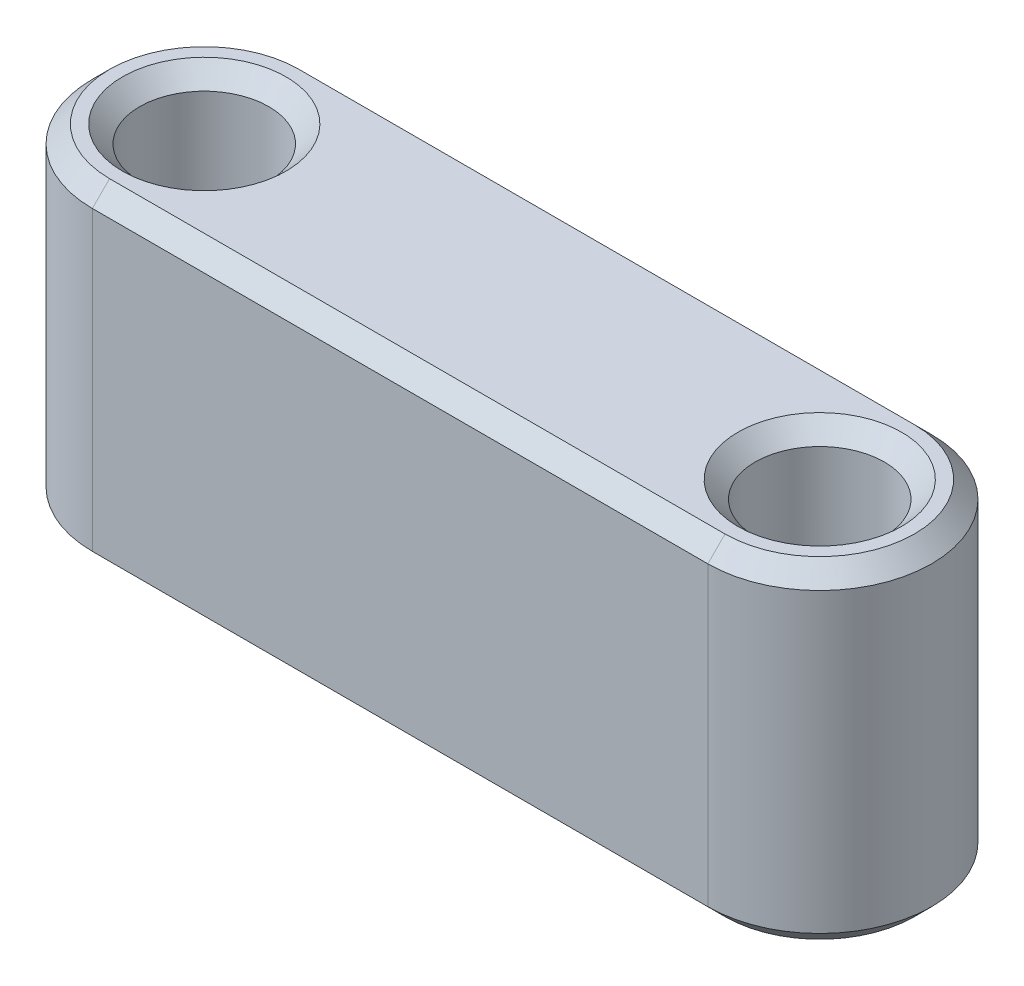
from build123d import *

# Parameters (mm, degrees)
SKETCH1_R           = 1.5
BOSS_EXTRUDE1_DEPTH = 3.85
CHAMFER2_SIZE       = 0.4


with BuildPart() as part:
    # Sketch1 → Boss-Extrude1 (new, symmetric)
    with BuildSketch(Plane(origin=(0, 0, 0), x_dir=(1, 0, 0), z_dir=(0, 1, 0))):
        with BuildLine():
            Line((-5.963610114, 2.6), (8.336389886, 2.6))
            ThreePointArc((8.336389886, 2.6), (10.936389886, 0), (8.336389886, -2.6))
            Line((8.336389886, -2.6), (-5.963610114, -2.6))
            ThreePointArc((-5.963610114, -2.6), (-8.563610114, 0), (-5.963610114, 2.6))
        make_face()
        with Locations(Location((-5.963610114, 0, 0), (0, 0, 90))):
            Circle(SKETCH1_R, mode=Mode.SUBTRACT)
        with Locations(Location((8.336389886, 0, 0), (0, 0, 90))):
            Circle(SKETCH1_R, mode=Mode.SUBTRACT)
    extrude(amount=BOSS_EXTRUDE1_DEPTH, both=True)

    # Chamfer2
    chamfer2_edges = [part.edges().sort_by_distance(p)[0] for p in [
        (-5.963610114, -3.85, 1.5),
        (-5.963610114, 3.85, 1.5),
        (10.936389886, 3.85, 0),
        (8.336389886, -3.85, 1.5),
        (8.336389886, 3.85, 1.5),
        (1.186389886, 3.85, -2.6),
        (-8.563610114, 3.85, 0),
        (1.186389886, -3.85, -2.6),
        (10.936389886, -3.85, 0),
        (1.186389886, -3.85, 2.6),
        (-8.563610114, -3.85, 0),
        (1.186389886, 3.85, 2.6),
    ]]
    chamfer(chamfer2_edges, length=CHAMFER2_SIZE)


solid = part.part
